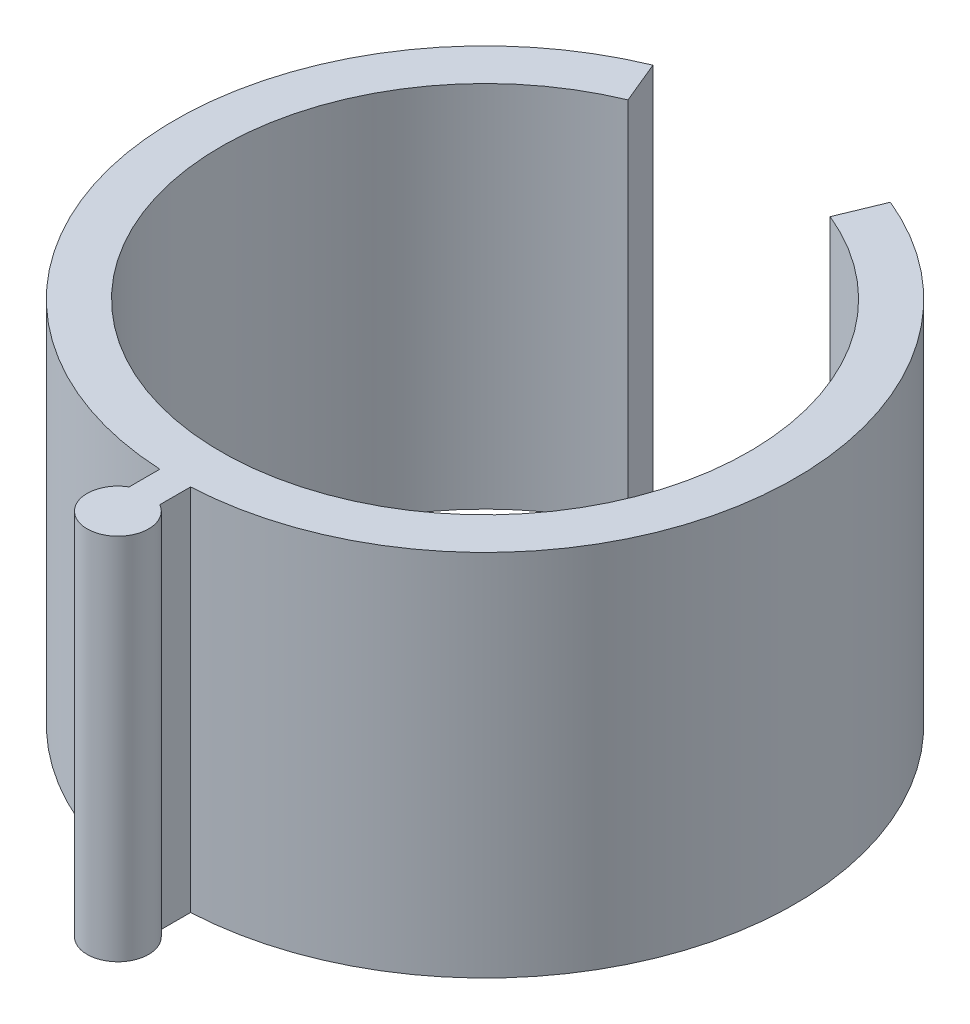
from build123d import *

# Parameters (mm, degrees)
BOSS_EXTRUDE1_DEPTH = 15.24


with BuildPart() as part:
    # Sketch1 → Boss-Extrude1 (new body)
    with BuildSketch(Plane(origin=(0, 0, 0), x_dir=(1, 0, 0), z_dir=(0, 1, 0))):
        with BuildLine():
            Line((-4.908680387, 11.850602764), (-4.179668448, 10.090612254))
            ThreePointArc((-4.179668448, 10.090612254), (0, -10.922), (4.179668448, 10.090612254))
            Line((4.179668448, 10.090612254), (4.908680387, 11.850602764))
            ThreePointArc((4.908680387, 11.850602764), (12.638636057, -2.19016155), (0.635, -12.811272536))
            Line((0.635, -12.811272536), (0.635, -14.081272536))
            ThreePointArc((0.635, -14.081272536), (0, -16.451124799), (-0.635, -14.081272536))
            Line((-0.635, -14.081272536), (-0.635, -12.811272536))
            ThreePointArc((-0.635, -12.811272536), (-12.638636057, -2.19016155), (-4.908680387, 11.850602764))
        make_face()
    extrude(amount=BOSS_EXTRUDE1_DEPTH)


solid = part.part
